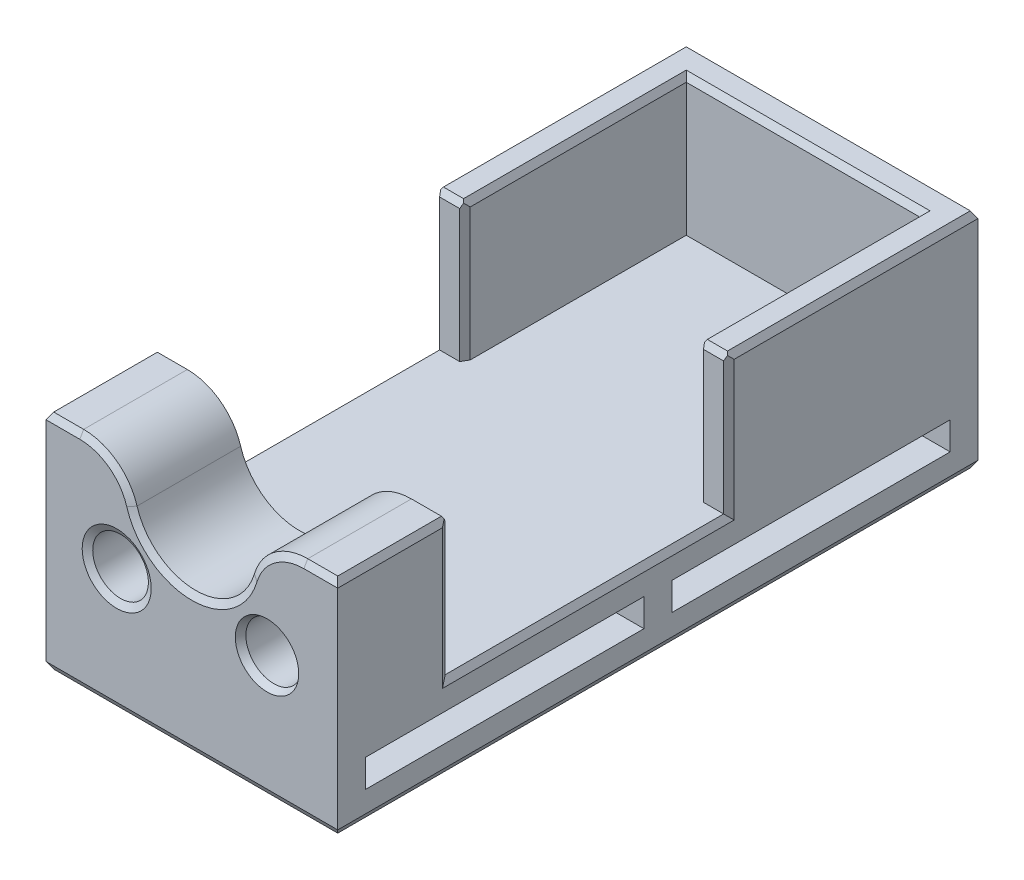
from build123d import *
from OCP.BRepFilletAPI import BRepFilletAPI_MakeChamfer

# Parameters (mm, degrees)
SKETCH_1_W               = 52.4
SKETCH_1_H               = 115
EXTRUDE_1_DEPTH          = 7.5
CUT_EXTRUDE_1_DEPTH      = 64.631281615
CUT_EXTRUDE_1_DEPTH_BACK = 64.631281615
SKETCH_2_W               = 50
SKETCH_2_H               = 5
SKETCH_3_W               = 52.4
SKETCH_3_H               = 25
EXTRUDE_2_DEPTH          = 5
SKETCH_4_W               = 5
SKETCH_4_H               = 25
EXTRUDE_3_DEPTH          = 40
EXTRUDE_4_DEPTH          = 20
FILLET_1_R               = 10
SKETCH_7_R               = 5
CUT_EXTRUDE_2_DEPTH      = 20
CHAMFER_1_SIZE           = 1.2
CHAMFER_1_SIZE2          = 0.692820323
CHAMFER_2_SIZE           = 1.2
CHAMFER_2_SIZE2          = 0.692820323
CHAMFER_3_SIZE           = 1.2
CHAMFER_3_SIZE2          = 0.692820323
CHAMFER_4_SIZE           = 1.2
CHAMFER_4_SIZE2          = 0.692820323


with BuildPart() as part:
    # 스케치1 → 보스-돌출1 (new, symmetric)
    with BuildSketch(Plane(origin=(0, 0, 0), x_dir=(1, 0, 0), z_dir=(0, 1, 0))):
        Rectangle(SKETCH_1_W, SKETCH_1_H)
    extrude(amount=EXTRUDE_1_DEPTH, both=True)

    # 스케치2 → 컷-돌출1 (cut, two sides: drawn at the far end of the back side and taken through both)
    with BuildSketch(Plane(origin=(0, 0, 0), x_dir=(0, 0, -1), z_dir=(1, 0, 0)).offset(-CUT_EXTRUDE_1_DEPTH_BACK)):
        with Locations((27.5, 0)):
            Rectangle(SKETCH_2_W, SKETCH_2_H)
        with Locations((-27.5, 0)):
            Rectangle(SKETCH_2_W, SKETCH_2_H)
    extrude(amount=CUT_EXTRUDE_1_DEPTH + CUT_EXTRUDE_1_DEPTH_BACK, mode=Mode.SUBTRACT)

    # 스케치3 → 보스-돌출2 (add)
    with BuildSketch(Plane(origin=(0, 0, -57.5), x_dir=(-1, 0, 0), z_dir=(0, 0, -1))):
        with Locations((0, 20)):
            Rectangle(SKETCH_3_W, SKETCH_3_H)
    extrude(amount=-EXTRUDE_2_DEPTH)

    # 스케치4 → 보스-돌출3 (add)
    with BuildSketch(Plane.XY.offset(-52.5)):
        with Locations((-23.7, 20)):
            Rectangle(SKETCH_4_W, SKETCH_4_H)
        with Locations((23.7, 20)):
            Rectangle(SKETCH_4_W, SKETCH_4_H)
    extrude(amount=EXTRUDE_3_DEPTH)

    # 스케치5 → 보스-돌출4 (add)
    with BuildSketch(Plane.XY.offset(57.5)):
        with BuildLine():
            Line((-10.246950766, 32.5), (-26.2, 32.5))
            Line((-26.2, 32.5), (-26.2, 7.5))
            Line((-26.2, 7.5), (26.2, 7.5))
            Line((26.2, 7.5), (26.2, 32.5))
            Line((26.2, 32.5), (10.246950766, 32.5))
            ThreePointArc((10.246950766, 32.5), (0, 17.5), (-10.246950766, 32.5))
        make_face()
    extrude(amount=-EXTRUDE_4_DEPTH)

    # 필렛1
    fillet_1_edges = [part.edges().sort_by_distance(p)[0] for p in [
        (-10.246950766, 32.5, 47.5),
        (10.246950766, 32.5, 47.5),
    ]]
    fillet(fillet_1_edges, radius=FILLET_1_R)

    # 스케치7 → 컷-돌출2 (cut)
    with BuildSketch(Plane.XY.offset(57.5)):
        with Locations((-13.5, 14.5)):
            Circle(SKETCH_7_R)
        with Locations((13.5, 14.5)):
            Circle(SKETCH_7_R)
    extrude(amount=-CUT_EXTRUDE_2_DEPTH, mode=Mode.SUBTRACT)

    # 모따기1: one chamfer whose edges measure the first distance from different faces: ONE call of the kernel's chamfer builder (chamfer() names one face for all edges)
    chamfer_1_edges_1 = [part.edges().sort_by_distance(p)[0] for p in [
        (-23.162305899, 32.5, 57.5),
        (-14.148468751, 30.517837257, 57.5),
        (14.148468751, 30.517837257, 57.5),
        (0, -7.5, 57.5),
        (23.162305899, 32.5, 57.5),
        (0, 17.5, 57.5),
    ]]
    chamfer_1_side_1 = [part.faces().sort_by_distance(p)[0] for p in [
        (0, 9.670777652, 57.5),
    ]]
    chamfer_1_edges_2 = [part.edges().sort_by_distance(p)[0] for p in [
        (0, 17.5, 37.5),
        (-23.162305899, 32.5, 37.5),
        (-14.148468751, 30.517837257, 37.5),
        (14.148468751, 30.517837257, 37.5),
        (23.162305899, 32.5, 37.5),
    ]]
    chamfer_1_side_2 = [part.faces().sort_by_distance(p)[0] for p in [
        (-23.162305899, 31.919417534, 37.5),
    ]]
    chamfer_1_edges_3 = [part.edges().sort_by_distance(p)[0] for p in [
        (26.2, 32.5, -35),
        (26.2, -7.5, 0),
        (26.2, 32.5, 47.5),
    ]]
    chamfer_1_side_3 = [part.faces().sort_by_distance(p)[0] for p in [
        (26.2, 12.5, 56.282420434),
    ]]
    chamfer_1_edges_4 = [part.edges().sort_by_distance(p)[0] for p in [
        (-26.2, 32.5, -35),
        (-26.2, -7.5, 0),
        (-26.2, 32.5, 47.5),
    ]]
    chamfer_1_side_4 = [part.faces().sort_by_distance(p)[0] for p in [
        (-26.2, -6.282420434, 0),
    ]]
    chamfer_1_edges_5 = [part.edges().sort_by_distance(p)[0] for p in [
        (0, 32.5, -57.5),
        (0, -7.5, -57.5),
    ]]
    chamfer_1_side_5 = [part.faces().sort_by_distance(p)[0] for p in [
        (0, 12.5, -57.5),
    ]]
    chamfer_1_edges_6 = [part.edges().sort_by_distance(p)[0] for p in [
        (0, 32.5, -52.5),
    ]]
    chamfer_1_side_6 = [part.faces().sort_by_distance(p)[0] for p in [
        (0, 20, -52.5),
    ]]
    chamfer_1_edges_7 = [part.edges().sort_by_distance(p)[0] for p in [
        (-21.2, 32.5, -32.5),
    ]]
    chamfer_1_side_7 = [part.faces().sort_by_distance(p)[0] for p in [
        (-21.2, 20, -32.5),
    ]]
    chamfer_1_edges_8 = [part.edges().sort_by_distance(p)[0] for p in [
        (-23.7, 32.5, -12.5),
    ]]
    chamfer_1_side_8 = [part.faces().sort_by_distance(p)[0] for p in [
        (-23.7, 20, -12.5),
    ]]
    chamfer_1_edges_9 = [part.edges().sort_by_distance(p)[0] for p in [
        (21.2, 32.5, -32.5),
    ]]
    chamfer_1_side_9 = [part.faces().sort_by_distance(p)[0] for p in [
        (21.2, 20, -32.5),
    ]]
    chamfer_1_edges_10 = [part.edges().sort_by_distance(p)[0] for p in [
        (23.7, 32.5, -12.5),
    ]]
    chamfer_1_side_10 = [part.faces().sort_by_distance(p)[0] for p in [
        (23.7, 20, -12.5),
    ]]
    chamfer_1 = BRepFilletAPI_MakeChamfer(part.part.solid().wrapped)
    for e in chamfer_1_edges_1:
        chamfer_1.Add(CHAMFER_1_SIZE, CHAMFER_1_SIZE2, e.wrapped, chamfer_1_side_1[0].wrapped)  # the first distance lies on this face
    for e in chamfer_1_edges_2:
        chamfer_1.Add(CHAMFER_1_SIZE, CHAMFER_1_SIZE2, e.wrapped, chamfer_1_side_2[0].wrapped)  # the first distance lies on this face
    for e in chamfer_1_edges_3:
        chamfer_1.Add(CHAMFER_1_SIZE, CHAMFER_1_SIZE2, e.wrapped, chamfer_1_side_3[0].wrapped)  # the first distance lies on this face
    for e in chamfer_1_edges_4:
        chamfer_1.Add(CHAMFER_1_SIZE, CHAMFER_1_SIZE2, e.wrapped, chamfer_1_side_4[0].wrapped)  # the first distance lies on this face
    for e in chamfer_1_edges_5:
        chamfer_1.Add(CHAMFER_1_SIZE, CHAMFER_1_SIZE2, e.wrapped, chamfer_1_side_5[0].wrapped)  # the first distance lies on this face
    for e in chamfer_1_edges_6:
        chamfer_1.Add(CHAMFER_1_SIZE, CHAMFER_1_SIZE2, e.wrapped, chamfer_1_side_6[0].wrapped)  # the first distance lies on this face
    for e in chamfer_1_edges_7:
        chamfer_1.Add(CHAMFER_1_SIZE, CHAMFER_1_SIZE2, e.wrapped, chamfer_1_side_7[0].wrapped)  # the first distance lies on this face
    for e in chamfer_1_edges_8:
        chamfer_1.Add(CHAMFER_1_SIZE, CHAMFER_1_SIZE2, e.wrapped, chamfer_1_side_8[0].wrapped)  # the first distance lies on this face
    for e in chamfer_1_edges_9:
        chamfer_1.Add(CHAMFER_1_SIZE, CHAMFER_1_SIZE2, e.wrapped, chamfer_1_side_9[0].wrapped)  # the first distance lies on this face
    for e in chamfer_1_edges_10:
        chamfer_1.Add(CHAMFER_1_SIZE, CHAMFER_1_SIZE2, e.wrapped, chamfer_1_side_10[0].wrapped)  # the first distance lies on this face
    add(Compound.cast(chamfer_1.Shape()), mode=Mode.REPLACE)

    # 모따기2: one chamfer whose edges measure the first distance from different faces: ONE call of the kernel's chamfer builder (chamfer() names one face for all edges)
    chamfer_2_edges_1 = [part.edges().sort_by_distance(p)[0] for p in [
        (-18.5, 14.5, 37.5),
    ]]
    chamfer_2_side_1 = [part.faces().sort_by_distance(p)[0] for p in [
        (-25.624482841, 19.4, 37.5),
    ]]
    chamfer_2_edges_2 = [part.edges().sort_by_distance(p)[0] for p in [
        (-18.5, 14.5, 57.5),
    ]]
    chamfer_2_side_2 = [part.faces().sort_by_distance(p)[0] for p in [
        (0, 9.52416619, 57.5),
    ]]
    chamfer_2_edges_3 = [part.edges().sort_by_distance(p)[0] for p in [
        (8.5, 14.5, 37.5),
        (8.5, 14.5, 57.5),
    ]]
    chamfer_2_side_3 = [part.faces().sort_by_distance(p)[0] for p in [
        (8.5, 14.5, 47.5),
    ]]
    chamfer_2 = BRepFilletAPI_MakeChamfer(part.part.solid().wrapped)
    for e in chamfer_2_edges_1:
        chamfer_2.Add(CHAMFER_2_SIZE, CHAMFER_2_SIZE2, e.wrapped, chamfer_2_side_1[0].wrapped)  # the first distance lies on this face
    for e in chamfer_2_edges_2:
        chamfer_2.Add(CHAMFER_2_SIZE, CHAMFER_2_SIZE2, e.wrapped, chamfer_2_side_2[0].wrapped)  # the first distance lies on this face
    for e in chamfer_2_edges_3:
        chamfer_2.Add(CHAMFER_2_SIZE, CHAMFER_2_SIZE2, e.wrapped, chamfer_2_side_3[0].wrapped)  # the first distance lies on this face
    add(Compound.cast(chamfer_2.Shape()), mode=Mode.REPLACE)

    # 모따기3: one chamfer whose edges measure the first distance from different faces: ONE call of the kernel's chamfer builder (chamfer() names one face for all edges)
    chamfer_3_edges_1 = [part.edges().sort_by_distance(p)[0] for p in [
        (-26.2, 7.5, 12.5),
    ]]
    chamfer_3_side_1 = [part.faces().sort_by_distance(p)[0] for p in [
        (-26.2, 12.5, 56.290092566),
    ]]
    chamfer_3_edges_2 = [part.edges().sort_by_distance(p)[0] for p in [
        (26.2, 7.5, 12.5),
    ]]
    chamfer_3_side_2 = [part.faces().sort_by_distance(p)[0] for p in [
        (26.2, 12.5, 56.290092566),
    ]]
    chamfer_3 = BRepFilletAPI_MakeChamfer(part.part.solid().wrapped)
    for e in chamfer_3_edges_1:
        chamfer_3.Add(CHAMFER_3_SIZE, CHAMFER_3_SIZE2, e.wrapped, chamfer_3_side_1[0].wrapped)  # the first distance lies on this face
    for e in chamfer_3_edges_2:
        chamfer_3.Add(CHAMFER_3_SIZE, CHAMFER_3_SIZE2, e.wrapped, chamfer_3_side_2[0].wrapped)  # the first distance lies on this face
    add(Compound.cast(chamfer_3.Shape()), mode=Mode.REPLACE)

    # 모따기4: one chamfer whose edges measure the first distance from different faces: ONE call of the kernel's chamfer builder (chamfer() names one face for all edges)
    chamfer_4_edges_1 = [part.edges().sort_by_distance(p)[0] for p in [
        (26.2, 18.8, 37.5),
        (26.2, 18.8, -12.5),
    ]]
    chamfer_4_side_1 = [part.faces().sort_by_distance(p)[0] for p in [
        (26.2, 18.8, 38.709907434),
    ]]
    chamfer_4_edges_2 = [part.edges().sort_by_distance(p)[0] for p in [
        (-26.2, 18.8, 37.5),
        (-26.2, 18.8, -12.5),
    ]]
    chamfer_4_side_2 = [part.faces().sort_by_distance(p)[0] for p in [
        (-26.2, 18.8, -13.709907434),
    ]]
    chamfer_4_edges_3 = [part.edges().sort_by_distance(p)[0] for p in [
        (21.2, 19.4, -12.5),
    ]]
    chamfer_4_side_3 = [part.faces().sort_by_distance(p)[0] for p in [
        (21.2, 19.4, -32.5),
    ]]
    chamfer_4_edges_4 = [part.edges().sort_by_distance(p)[0] for p in [
        (-21.2, 19.4, -12.5),
    ]]
    chamfer_4_side_4 = [part.faces().sort_by_distance(p)[0] for p in [
        (-21.2, 19.4, -32.5),
    ]]
    chamfer_4 = BRepFilletAPI_MakeChamfer(part.part.solid().wrapped)
    for e in chamfer_4_edges_1:
        chamfer_4.Add(CHAMFER_4_SIZE, CHAMFER_4_SIZE2, e.wrapped, chamfer_4_side_1[0].wrapped)  # the first distance lies on this face
    for e in chamfer_4_edges_2:
        chamfer_4.Add(CHAMFER_4_SIZE, CHAMFER_4_SIZE2, e.wrapped, chamfer_4_side_2[0].wrapped)  # the first distance lies on this face
    for e in chamfer_4_edges_3:
        chamfer_4.Add(CHAMFER_4_SIZE, CHAMFER_4_SIZE2, e.wrapped, chamfer_4_side_3[0].wrapped)  # the first distance lies on this face
    for e in chamfer_4_edges_4:
        chamfer_4.Add(CHAMFER_4_SIZE, CHAMFER_4_SIZE2, e.wrapped, chamfer_4_side_4[0].wrapped)  # the first distance lies on this face
    add(Compound.cast(chamfer_4.Shape()), mode=Mode.REPLACE)


solid = part.part
